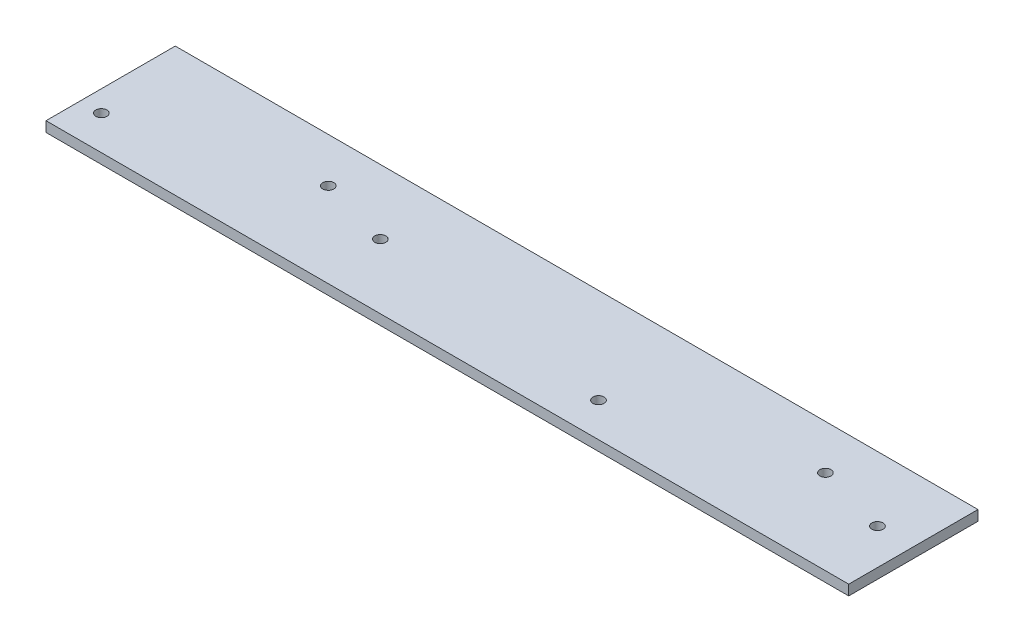
from build123d import *

# Parameters (mm, degrees)
SKETCH1_W           = 229.301766186
SKETCH1_H           = 36.931173376
SKETCH1_R           = 1.5875
BOSS_EXTRUDE1_DEPTH = 1.4605


with BuildPart() as part:
    # Sketch1 → Boss-Extrude1 (new, symmetric)
    with BuildSketch(Plane(origin=(0, 0, 0), x_dir=(1, 0, 0), z_dir=(0, 1, 0))):
        with Locations((37.605218443, 0)):
            Rectangle(SKETCH1_W, SKETCH1_H)
        with Locations(Location((-71, -8.695, 0), (0, 0, 270))):
            Circle(SKETCH1_R, mode=Mode.SUBTRACT)
        with Locations(Location((71, -8.695, 0), (0, 0, 270))):
            Circle(SKETCH1_R, mode=Mode.SUBTRACT)
        with Locations(Location((0, 0, 0), (0, 0, 270))):
            Circle(SKETCH1_R, mode=Mode.SUBTRACT)
        with Locations(Location((-20.62, 5.75, 0), (0, 0, 270))):
            Circle(SKETCH1_R, mode=Mode.SUBTRACT)
        with Locations(Location((142, 0, 0), (0, 0, 270))):
            Circle(SKETCH1_R, mode=Mode.SUBTRACT)
        with Locations(Location((121.38, 5.74999993, 0), (0, 0, 270))):
            Circle(SKETCH1_R, mode=Mode.SUBTRACT)
    extrude(amount=BOSS_EXTRUDE1_DEPTH, both=True)


solid = part.part
